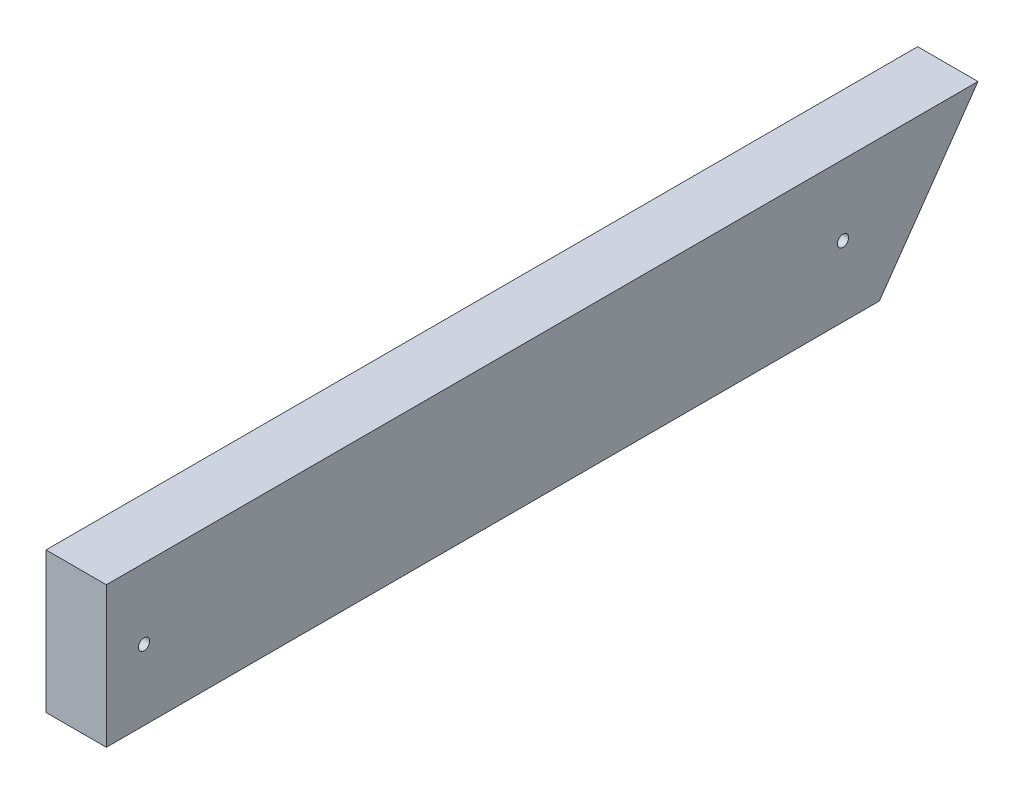
from build123d import *

# Parameters (mm, degrees)
BOSS_EXTRUDE1_DEPTH = 38.1
SKETCH2_R           = 3.571875
CUT_EXTRUDE1_DEPTH  = 559.820020083


with BuildPart() as part:
    # Sketch1 → Boss-Extrude1 (new body)
    with BuildSketch(Plane(origin=(0, 0, 0), x_dir=(0, 0, -1), z_dir=(1, 0, 0))):
        Polygon((0, 88.9), (550.386223343, 88.9), (488.137773196, 0), (0, 0), align=None)
    extrude(amount=BOSS_EXTRUDE1_DEPTH)

    # Sketch2 → Cut-Extrude1 (cut, through all)
    with BuildSketch(Plane(origin=(38.1, 0, 0), x_dir=(0, 0, -1), z_dir=(1, 0, 0))):
        with Locations((23.8125, 44.45)):
            Circle(SKETCH2_R)
        with Locations((465.1375, 44.45)):
            Circle(SKETCH2_R)
    extrude(amount=-CUT_EXTRUDE1_DEPTH, mode=Mode.SUBTRACT)


solid = part.part
